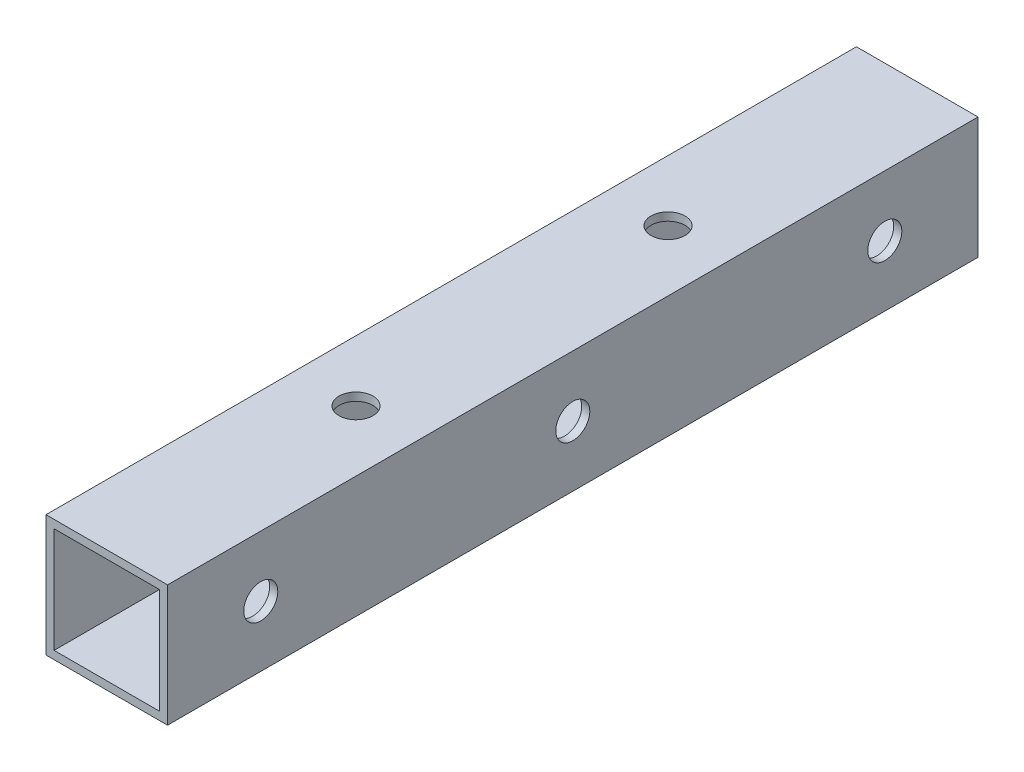
from build123d import *

# Parameters (mm, degrees)
SKETCH_1_W          = 15
SKETCH_1_H          = 15
SKETCH_1_W_2        = 13
SKETCH_1_H_2        = 13
EXTRUDE_1_DEPTH     = 100
SKETCH_2_R          = 2.1
CUT_EXTRUDE_1_DEPTH = 366
SKETCH_3_R          = 2.1
CUT_EXTRUDE_2_DEPTH = 55


with BuildPart() as part:
    # 草图1 → 凸台-拉伸1 (new body)
    with BuildSketch(Plane.XY):
        Rectangle(SKETCH_1_W, SKETCH_1_H)
        Rectangle(SKETCH_1_W_2, SKETCH_1_H_2, mode=Mode.SUBTRACT)
    extrude(amount=EXTRUDE_1_DEPTH)

    # 草图2 → 切除-拉伸1 (cut)
    with BuildSketch(Plane(origin=(7.5, 0, 0), x_dir=(0, 0, -1), z_dir=(1, 0, 0))):
        with Locations(Location((-50, 0, 0), (0, 0, 90))):
            Circle(SKETCH_2_R)
        with Locations(Location((-88.5, 0, 0), (0, 0, 90))):
            Circle(SKETCH_2_R)
        with Locations(Location((-11.5, 0, 0), (0, 0, 90))):
            Circle(SKETCH_2_R)
    extrude(amount=-CUT_EXTRUDE_1_DEPTH, mode=Mode.SUBTRACT)

    # 草图3 → 切除-拉伸2 (cut)
    with BuildSketch(Plane(origin=(0, 7.5, 0), x_dir=(1, 0, 0), z_dir=(0, 1, 0))):
        with Locations(Location((0, -30.75, 0), (0, 0, 270))):
            Circle(SKETCH_3_R)
        with Locations(Location((0, -69.25, 0), (0, 0, 270))):
            Circle(SKETCH_3_R)
    extrude(amount=-CUT_EXTRUDE_2_DEPTH, mode=Mode.SUBTRACT)


solid = part.part
